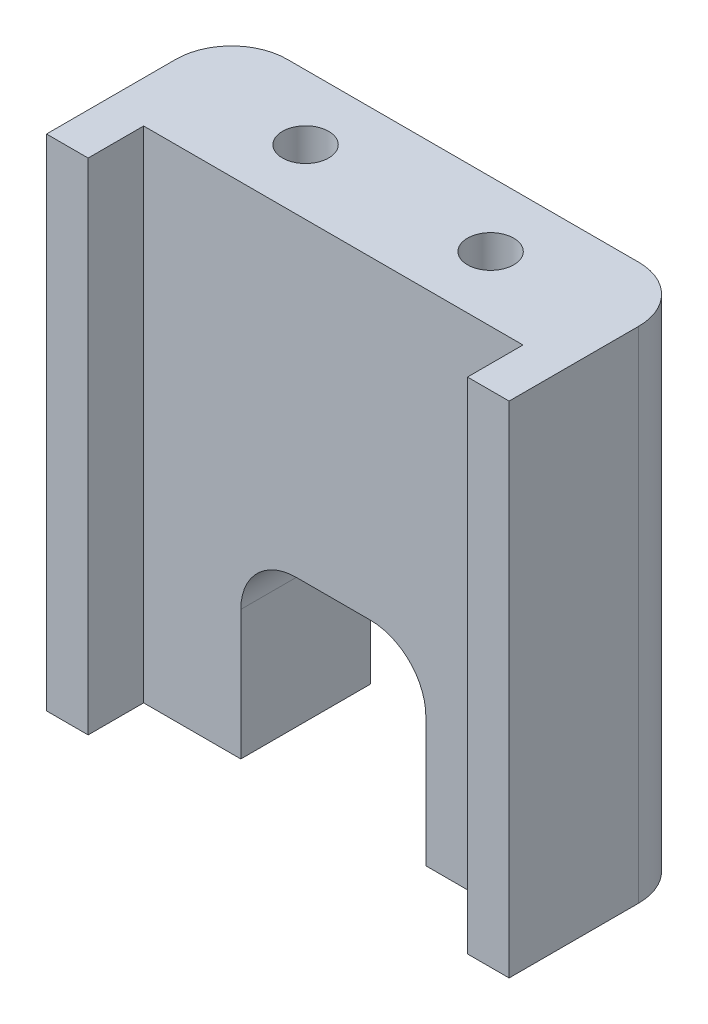
from build123d import *

# Parameters (mm, degrees)
SKETCH_1_W          = 25
SKETCH_1_H          = 27
EXTRUDE_1_DEPTH     = 10
SKETCH_2_W          = 20.5
SKETCH_2_H          = 27
CUT_EXTRUDE_1_DEPTH = 3
SKETCH_3_R          = 1.25
CUT_EXTRUDE_2_DEPTH = 12
SKETCH_4_R          = 1.25
CUT_EXTRUDE_3_DEPTH = 12
SKETCH_5_W          = 10
SKETCH_5_H          = 10
CUT_EXTRUDE_4_DEPTH = 12
FILLET_1_R          = 3


with BuildPart() as part:
    # 스케치1 → 보스-돌출1 (new body)
    with BuildSketch(Plane.XY):
        with Locations((12.5, 13.5)):
            Rectangle(SKETCH_1_W, SKETCH_1_H)
    extrude(amount=EXTRUDE_1_DEPTH)

    # 스케치2 → 컷-돌출1 (cut)
    with BuildSketch(Plane.XY.offset(10)):
        with Locations((12.5, 13.5)):
            Rectangle(SKETCH_2_W, SKETCH_2_H)
    extrude(amount=-CUT_EXTRUDE_1_DEPTH, mode=Mode.SUBTRACT)

    # 스케치3 → 컷-돌출2 (cut)
    with BuildSketch(Plane(origin=(0, 27, 0), x_dir=(1, 0, 0), z_dir=(0, 1, 0))):
        with Locations(Location((7.5, -3.5, 0), (0, 0, 270))):
            Circle(SKETCH_3_R)
        with Locations(Location((17.5, -3.5, 0), (0, 0, 270))):
            Circle(SKETCH_3_R)
    extrude(amount=-CUT_EXTRUDE_2_DEPTH, mode=Mode.SUBTRACT)

    # 스케치4 → 컷-돌출3 (cut)
    with BuildSketch(Plane.XZ):
        with Locations(Location((3.5, 3.5, 0), (0, 0, 270))):
            Circle(SKETCH_4_R)
        with Locations(Location((21.5, 3.5, 0), (0, 0, 270))):
            Circle(SKETCH_4_R)
    extrude(amount=-CUT_EXTRUDE_3_DEPTH, mode=Mode.SUBTRACT)

    # 스케치5 → 컷-돌출4 (cut)
    with BuildSketch(Plane(origin=(0, 0, 0), x_dir=(-1, 0, 0), z_dir=(0, 0, -1))):
        with Locations((-12.5, 5)):
            Rectangle(SKETCH_5_W, SKETCH_5_H)
    extrude(amount=-CUT_EXTRUDE_4_DEPTH, mode=Mode.SUBTRACT)

    # 필렛1
    fillet_1_edges = [part.edges().sort_by_distance(p)[0] for p in [
        (25, 13.5, 0),
        (17.5, 10, 3.5),
        (7.5, 10, 3.5),
        (0, 13.5, 0),
    ]]
    fillet(fillet_1_edges, radius=FILLET_1_R)


solid = part.part
